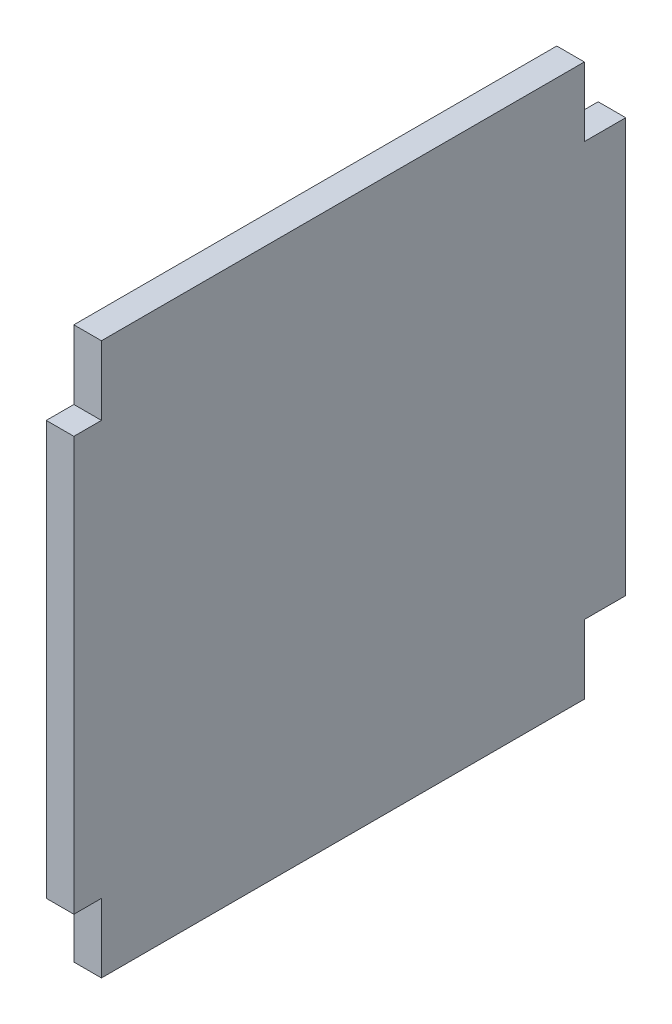
from build123d import *

# Parameters (mm, degrees)
ESTRUSIONE_ESTRUSIONE1_DEPTH      = 37
ESTRUSIONE_ESTRUSIONE1_DEPTH_BACK = 3
SCHIZZO1_W                        = 2
SCHIZZO1_H                        = 30
SCHIZZO2_W                        = 2
SCHIZZO2_H                        = 35
ESTRUSIONE_ESTRUSIONE2_DEPTH      = 5


with BuildPart() as part:
    # Schizzo1 → Estrusione-Estrusione1 (new, two sides: drawn at the far end of the back side and taken through both)
    with BuildSketch(Plane.XY.offset(-ESTRUSIONE_ESTRUSIONE1_DEPTH_BACK)):
        with Locations((215, 0)):
            Rectangle(SCHIZZO1_W, SCHIZZO1_H)
    extrude(amount=ESTRUSIONE_ESTRUSIONE1_DEPTH + ESTRUSIONE_ESTRUSIONE1_DEPTH_BACK)

    # Schizzo2 → Estrusione-Estrusione2 (add)
    with BuildSketch(Plane.XZ.offset(15)):
        with Locations((215, 17.5)):
            Rectangle(SCHIZZO2_W, SCHIZZO2_H)
    estrusione_estrusione2 = extrude(amount=ESTRUSIONE_ESTRUSIONE2_DEPTH)

    # Specchia1: Estrusione-Estrusione2 across plane
    add(estrusione_estrusione2.mirror(Plane.ZX))


solid = part.part
